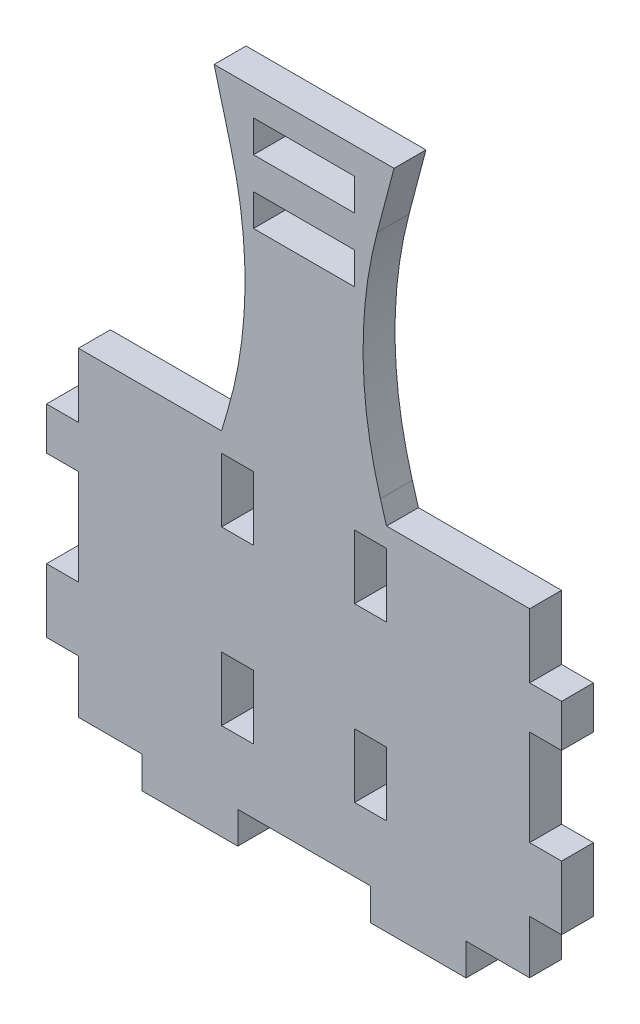
from build123d import *

# Parameters (mm, degrees)
SKETCH1_W           = 6
SKETCH1_H           = 12
SKETCH1_W_2         = 19.012644139
SKETCH1_H_2         = 6
BOSS_EXTRUDE1_DEPTH = 6


with BuildPart() as part:
    # Sketch1 → Boss-Extrude1 (new body)
    with BuildSketch(Plane.XY):
        with BuildLine():
            Line((-71.009489367, -30.923530446), (-71.009489367, -48.923530446))
            Line((-71.009489367, -48.923530446), (-77.009489367, -48.923530446))
            Line((-77.009489367, -48.923530446), (-77.009489367, -60.923530446))
            Line((-77.009489367, -60.923530446), (-71.009489367, -60.923530446))
            Line((-71.009489367, -60.923530446), (-71.009489367, -70.923530446))
            Line((-71.009489367, -70.923530446), (-59.069535867, -70.923530446))
            Line((-59.069535867, -70.923530446), (-59.069535867, -76.923530446))
            Line((-59.069535867, -76.923530446), (-41.069535867, -76.923530446))
            Line((-41.069535867, -76.923530446), (-41.069535867, -70.923530446))
            Line((-41.069535867, -70.923530446), (-16.155263667, -70.923530446))
            Line((-16.155263667, -70.923530446), (-16.155263667, -76.923530446))
            Line((-16.155263667, -76.923530446), (1.844736333, -76.923530446))
            Line((1.844736333, -76.923530446), (1.844736333, -70.923530446))
            Line((1.844736333, -70.923530446), (13.784689833, -70.923530446))
            Line((13.784689833, -70.923530446), (13.784689833, -60.923530446))
            Line((13.784689833, -60.923530446), (19.784689833, -60.923530446))
            Line((19.784689833, -60.923530446), (19.784689833, -48.923530446))
            Line((19.784689833, -48.923530446), (13.784689833, -48.923530446))
            Line((13.784689833, -48.923530446), (13.784689833, -30.923530446))
            Line((13.784689833, -30.923530446), (19.784689833, -30.923530446))
            Line((19.784689833, -30.923530446), (19.784689833, -22.923530446))
            Line((19.784689833, -22.923530446), (13.784689833, -22.923530446))
            Line((13.784689833, -22.923530446), (13.784689833, -10.85146976))
            Line((13.784689833, -10.85146976), (-13.112399767, -10.85146976))
            Line((-13.112399767, -10.85146976), (-14.257146074, -6.967198767))
            ThreePointArc((-14.257146074, -6.967198767), (-17.512012302, 14.497312555), (-14.875995677, 36.046577434))
            Line((-14.875995677, 36.046577434), (-11.701450566, 48.085223564))
            Line((-11.701450566, 48.085223564), (-45.510704829, 48.085223564))
            Line((-45.510704829, 48.085223564), (-42.338764303, 36.045890917))
            ThreePointArc((-42.338764303, 36.045890917), (-39.707407485, 14.496217042), (-42.966828756, -6.967441914))
            Line((-42.966828756, -6.967441914), (-44.112399767, -10.85146976))
            Line((-44.112399767, -10.85146976), (-71.009489367, -10.85146976))
            Line((-71.009489367, -10.85146976), (-71.009489367, -22.923530446))
            Line((-71.009489367, -22.923530446), (-77.009489367, -22.923530446))
            Line((-77.009489367, -22.923530446), (-77.009489367, -30.923530446))
            Line((-77.009489367, -30.923530446), (-71.009489367, -30.923530446))
        make_face()
        with Locations((-41.112399767, -52.830649895)):
            Rectangle(SKETCH1_W, SKETCH1_H, mode=Mode.SUBTRACT)
        with Locations((-41.112399767, -20.484459594)):
            Rectangle(SKETCH1_W, SKETCH1_H, mode=Mode.SUBTRACT)
        with Locations((-16.112399767, -20.484459594)):
            Rectangle(SKETCH1_W, SKETCH1_H, mode=Mode.SUBTRACT)
        with Locations((-16.112399767, -52.830649895)):
            Rectangle(SKETCH1_W, SKETCH1_H, mode=Mode.SUBTRACT)
        with Locations((-28.606077697, 40.085223564)):
            Rectangle(SKETCH1_W_2, SKETCH1_H_2, mode=Mode.SUBTRACT)
        with Locations((-28.606077697, 28.085223564)):
            Rectangle(SKETCH1_W_2, SKETCH1_H_2, mode=Mode.SUBTRACT)
    extrude(amount=BOSS_EXTRUDE1_DEPTH)


solid = part.part
